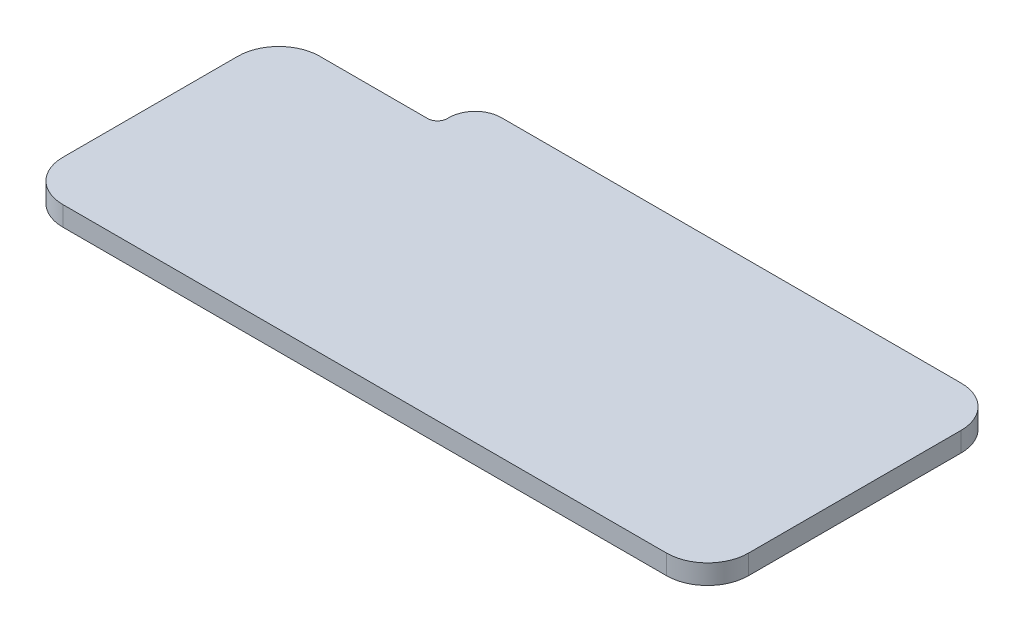
from build123d import *

# Parameters (mm, degrees)
EXTRUDE_1_DEPTH = 12


with BuildPart() as part:
    # Эскиз1 → Бобышка-Вытянуть1 (new body)
    with BuildSketch(Plane(origin=(0, 0, 0), x_dir=(1, 0, 0), z_dir=(0, 1, 0))):
        with BuildLine():
            Line((0, 0), (297, 0))
            ThreePointArc((297, 0), (314.67766953, 7.32233047), (322, 25))
            Line((322, 25), (322, 155))
            ThreePointArc((322, 155), (314.67766953, 172.67766953), (297, 180))
            Line((297, 180), (16, 180))
            ThreePointArc((16, 180), (4.686291501, 175.313708499), (0, 164))
            Line((0, 164), (0, 162.982))
            ThreePointArc((0, 162.982), (-1.757359313, 158.739359313), (-6, 156.982))
            Line((-6, 156.982), (-72, 156.982))
            ThreePointArc((-72, 156.982), (-89.67766953, 149.65966953), (-97, 131.982))
            Line((-97, 131.982), (-97, 25))
            ThreePointArc((-97, 25), (-89.67766953, 7.32233047), (-72, 0))
            Line((-72, 0), (0, 0))
        make_face()
    extrude(amount=EXTRUDE_1_DEPTH)


solid = part.part
